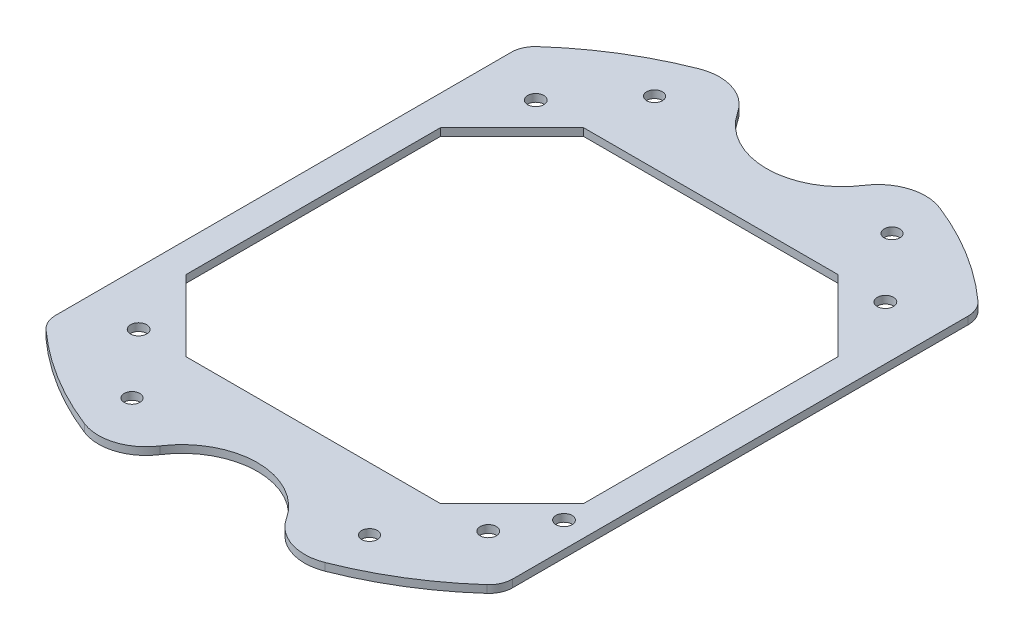
from build123d import *

# Parameters (mm, degrees)
BOSS_EXTRUDE1_DEPTH                     = 1.6
ENCLOSURE_MOUNTING_HOLES_M3_CLEARANCE_D = 3.4
BULKHEAD_MOUNTING_HOLES_M4X0_7_TAPPED_D = 3.3
SKETCH14_R                              = 1.7
CUT_EXTRUDE1_DEPTH                      = 82.171141516
CUT_EXTRUDE3_DEPTH                      = 10


with BuildPart() as part:
    # Sketch1 → Boss-Extrude1 (new body)
    with BuildSketch(Plane(origin=(0, 0, 0), x_dir=(1, 0, 0), z_dir=(0, 1, 0))):
        with BuildLine():
            Line((-48.093300583, -47.950176286), (-48.093300583, 47.950176286))
            ThreePointArc((-48.093300583, 47.950176286), (-47.660075225, 49.985997832), (-46.435472835, 51.669031572))
            ThreePointArc((-46.435472835, 51.669031572), (-36.474980605, 59.122903776), (-25.344708101, 64.680659646))
            ThreePointArc((-25.344708101, 64.680659646), (-18.640624701, 64.891621686), (-13.31129345, 60.818850193))
            ThreePointArc((-13.31129345, 60.818850193), (0, 53.594), (13.31129345, 60.818850193))
            ThreePointArc((13.31129345, 60.818850193), (18.640624701, 64.891621686), (25.344708101, 64.680659646))
            ThreePointArc((25.344708101, 64.680659646), (36.474980605, 59.122903776), (46.435472835, 51.669031572))
            ThreePointArc((46.435472835, 51.669031572), (47.660075225, 49.985997832), (48.093300583, 47.950176286))
            Line((48.093300583, 47.950176286), (48.093300583, -47.950176286))
            ThreePointArc((48.093300583, -47.950176286), (47.660075225, -49.985997832), (46.435472835, -51.669031572))
            ThreePointArc((46.435472835, -51.669031572), (36.474980605, -59.122903776), (25.344708101, -64.680659646))
            ThreePointArc((25.344708101, -64.680659646), (18.640624701, -64.891621686), (13.31129345, -60.818850193))
            ThreePointArc((13.31129345, -60.818850193), (0, -53.594), (-13.31129345, -60.818850193))
            ThreePointArc((-13.31129345, -60.818850193), (-18.640624701, -64.891621686), (-25.344708101, -64.680659646))
            ThreePointArc((-25.344708101, -64.680659646), (-36.474980605, -59.122903776), (-46.435472835, -51.669031572))
            ThreePointArc((-46.435472835, -51.669031572), (-47.660075225, -49.985997832), (-48.093300583, -47.950176286))
        make_face()
    extrude(amount=-BOSS_EXTRUDE1_DEPTH)

    # Enclosure Mounting Holes - M3 Clearance Hole1 (through all)
    with Locations(Plane(origin=(0, 0, 0), x_dir=(1, 0, 0), z_dir=(0, 1, 0))):
        with Locations((-36.8, 41.8), (-36.8, -41.8), (36.8, -41.8), (36.8, 41.8)):
            Hole(ENCLOSURE_MOUNTING_HOLES_M3_CLEARANCE_D / 2)

    # Bulkhead Mounting Holes - M4x0.7 Tapped Hole1 (through all)
    with Locations(Plane(origin=(0, 0, 0), x_dir=(1, 0, 0), z_dir=(0, 1, 0))):
        with Locations((-25, 55), (25, 55), (25, -55), (-25, -55)):
            Hole(BULKHEAD_MOUNTING_HOLES_M4X0_7_TAPPED_D / 2)

    # Sketch14 → Cut-Extrude1 (cut, through all)
    with BuildSketch(Plane(origin=(0, 0, 0), x_dir=(1, 0, 0), z_dir=(0, 1, 0))):
        with Locations(Location((42.75, -31.8, 0), (0, 0, 270))):
            Circle(SKETCH14_R)
    extrude(amount=-CUT_EXTRUDE1_DEPTH, mode=Mode.SUBTRACT)

    # Sketch17 → Cut-Extrude3 (cut)
    with BuildSketch(Plane(origin=(0, 0, 0), x_dir=(1, 0, 0), z_dir=(0, 1, 0))):
        Polygon((-26.8, -41.8), (-41.8, -26.8), (-41.8, 26.8), (-26.8, 41.8), (26.8, 41.8), (41.8, 26.8), (41.8, -26.8), (26.8, -41.8), align=None)
    extrude(amount=-CUT_EXTRUDE3_DEPTH, mode=Mode.SUBTRACT)


solid = part.part
